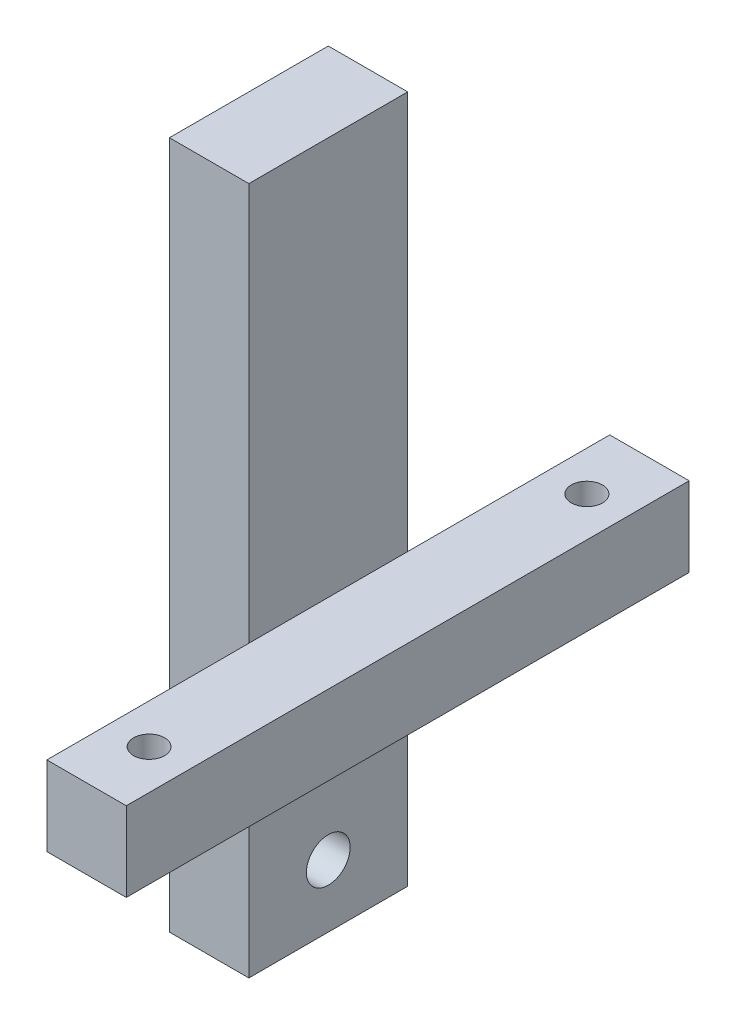
from build123d import *

# Parameters (mm, degrees)
CROQUIS1_W              = 12.7
CROQUIS1_H              = 25.4
SALIENTE_EXTRUIR1_DEPTH = 110
CROQUIS2_W              = 90
CROQUIS2_H              = 12.7
SALIENTE_EXTRUIR2_DEPTH = 12.7
CROQUIS3_R              = 3.5
CORTAR_EXTRUIR1_DEPTH   = 120.525269295
CROQUIS4_R              = 2.494853736
CROQUIS4_R_2            = 2.482276025
CORTAR_EXTRUIR2_DEPTH   = 81.244781762


with BuildPart() as part:
    # Croquis1 → Saliente-Extruir1 (new body)
    with BuildSketch(Plane(origin=(0, 0, 0), x_dir=(1, 0, 0), z_dir=(0, 1, 0))):
        Rectangle(CROQUIS1_W, CROQUIS1_H)
    extrude(amount=SALIENTE_EXTRUIR1_DEPTH)

    # Croquis2 → Saliente-Extruir2 (add)
    with BuildSketch(Plane(origin=(6.35, 0, 0), x_dir=(0, 0, -1), z_dir=(1, 0, 0))):
        with Locations((0, 40)):
            Rectangle(CROQUIS2_W, CROQUIS2_H)
    extrude(amount=SALIENTE_EXTRUIR2_DEPTH)

    # Croquis3 → Cortar-Extruir1 (cut, through all)
    with BuildSketch(Plane(origin=(6.35, 0, 0), x_dir=(0, 0, -1), z_dir=(1, 0, 0))):
        with Locations((0, 10)):
            Circle(CROQUIS3_R)
    extrude(amount=-CORTAR_EXTRUIR1_DEPTH, mode=Mode.SUBTRACT)

    # Croquis4 → Cortar-Extruir2 (cut, through all)
    with BuildSketch(Plane(origin=(0, 46.35, 0), x_dir=(1, 0, 0), z_dir=(0, 1, 0))):
        with Locations(Location((12.7, 35, 0), (0, 0, 270))):
            Circle(CROQUIS4_R)
        with Locations(Location((12.7, -35, 0), (0, 0, 270))):
            Circle(CROQUIS4_R_2)
    extrude(amount=-CORTAR_EXTRUIR2_DEPTH, mode=Mode.SUBTRACT)


solid = part.part
